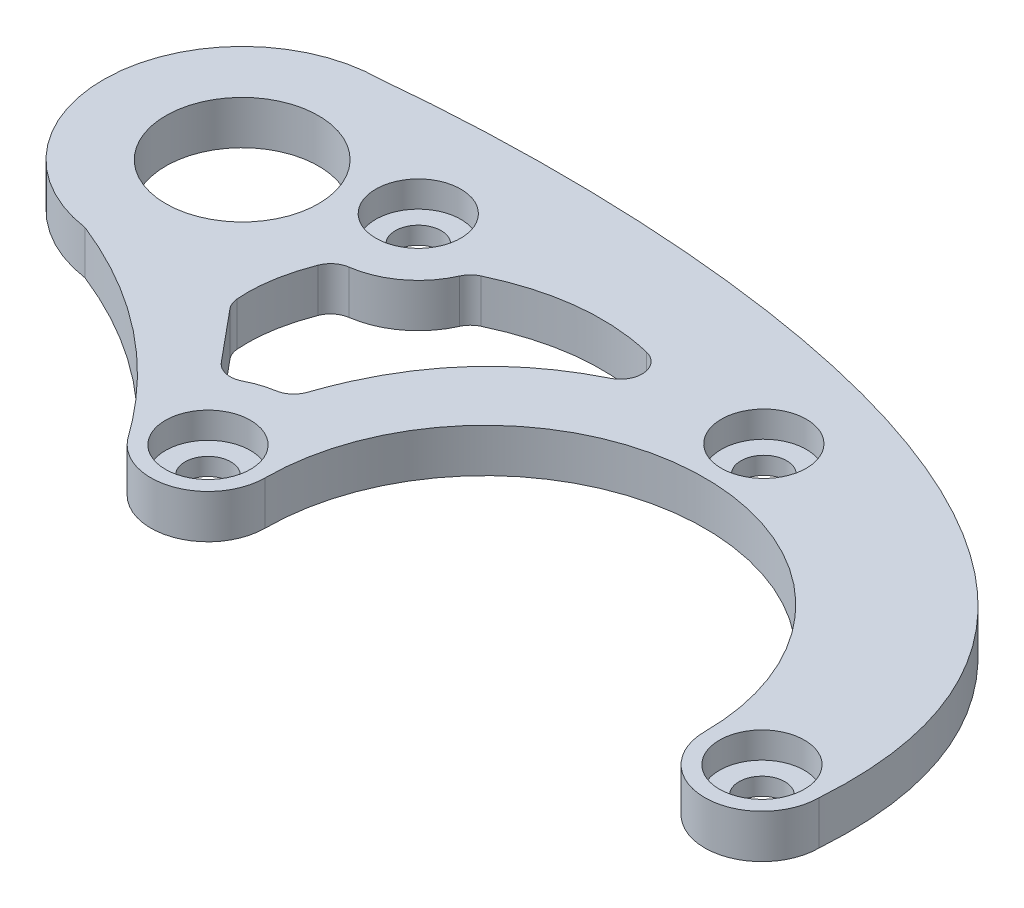
from build123d import *

# Parameters (mm, degrees)
SKETCH1_R           = 2.1
SKETCH1_R_2         = 7
BOSS_EXTRUDE1_DEPTH = 4
FILLET1_R           = 2
SKETCH2_R           = 3.9
CUT_EXTRUDE1_DEPTH  = 2.4


with BuildPart() as part:
    # Sketch1 → Boss-Extrude1 (new body)
    with BuildSketch(Plane(origin=(0, 0, 0), x_dir=(1, 0, 0), z_dir=(0, 1, 0))):
        with BuildLine():
            ThreePointArc((-20.156225815, 0), (0, 20.156225815), (20.156225815, 0))
            ThreePointArc((20.156225815, 0), (25.4, -5.243774185), (30.643774185, 0))
            add(Edge.make_bspline(
                [(-46.474516908, 36.934762739), (-23.164206568, 39.351897946), (33.373901801, 38.120150773), (30.643774185, 0)],
                knots=[0, 0, 0, 0, 1, 1, 1, 1], degree=3))
            ThreePointArc((-46.474516908, 36.934762739), (-59.166363236, 25.114100216), (-48.276532762, 11.615114404))
            add(Edge.make_bspline(
                [(-48.276532762, 11.615114404), (-40.793059369, 8.635332343), (-34.627763453, 3.802891886), (-29.780645012, -2.882206965)],
                knots=[0.158174001, 0.158174001, 0.158174001, 0.158174001, 0.985694322, 0.985694322, 0.985694322, 0.985694322], degree=3))
            add(Edge.make_bspline(
                [(-29.780645012, -2.882206965), (-29.696850917, -2.997774969), (-29.613450765, -3.113896649), (-29.530444557, -3.230572003)],
                knots=[0.985694322, 0.985694322, 0.985694322, 0.985694322, 1, 1, 1, 1], degree=3))
            ThreePointArc((-29.530444557, -3.230572003), (-23.691484685, -4.957634831), (-20.156225815, 0))
        make_face()
        with Locations(Location((-25.4, 0, 0), (0, 0, 270))):
            Circle(SKETCH1_R, mode=Mode.SUBTRACT)
        with Locations(Location((25.4, 0, 0), (0, 0, 270))):
            Circle(SKETCH1_R, mode=Mode.SUBTRACT)
        with Locations(Location((-46.474516908, 24.210813251, 0), (0, 0, 270))):
            Circle(SKETCH1_R_2, mode=Mode.SUBTRACT)
        with BuildLine():
            Line((-30.18742995, 5.773258566), (-35.582829026, 12.279679392))
            add(Edge.make_bspline(
                [(-34.116347467, 20.501234406), (-35.438334408, 17.651696826), (-35.927161595, 14.911178488), (-35.582829026, 12.279679392)],
                knots=[0, 0, 0, 0, 0.482948313, 0.482948313, 0.482948313, 0.482948313], degree=3))
            ThreePointArc((-34.116347467, 20.501234406), (-29.755996604, 21.898993805), (-27.020904781, 25.57127698))
            add(Edge.make_bspline(
                [(-27.020904781, 25.57127698), (-17.402553682, 30.495527598), (-7.5, 25.57127698)],
                knots=[0, 0, 0, 1, 1, 1], degree=2))
            add(Edge.make_bspline(
                [(-7.5, 25.57127698), (-21.293728183, 21.457376491), (-25.4, 7.5)],
                knots=[0, 0, 0, 1, 1, 1], degree=2))
            ThreePointArc((-25.4, 7.5), (-27.944657222, 7.0551201), (-30.18742995, 5.773258566))
        make_face(mode=Mode.SUBTRACT)
        with Locations(Location((-34.116347467, 28.001234406, 0), (0, 0, 270))):
            Circle(SKETCH1_R, mode=Mode.SUBTRACT)
        with Locations(Location((0, 25.57127698, 0), (0, 0, 270))):
            Circle(SKETCH1_R, mode=Mode.SUBTRACT)
    extrude(amount=BOSS_EXTRUDE1_DEPTH)

    # Fillet1
    fillet1_edges = [part.edges().sort_by_distance(p)[0] for p in [
        (-34.116347467, 2, -20.501234406),
        (-35.582829026, 2, -12.279679392),
        (-30.18742995, 2, -5.773258566),
        (-25.4, 2, -7.5),
        (-7.5, 2, -25.57127698),
        (-27.020904781, 2, -25.57127698),
    ]]
    fillet(fillet1_edges, radius=FILLET1_R)

    # Sketch2 → Cut-Extrude1 (cut)
    with BuildSketch(Plane(origin=(0, 4, 0), x_dir=(1, 0, 0), z_dir=(0, 1, 0))):
        with Locations(Location((-34.116347467, 28.001234406, 0), (0, 0, 270))):
            Circle(SKETCH2_R)
        with Locations(Location((0, 25.57127698, 0), (0, 0, 270))):
            Circle(SKETCH2_R)
        with Locations(Location((-25.4, 0, 0), (0, 0, 270))):
            Circle(SKETCH2_R)
        with Locations(Location((25.4, 0, 0), (0, 0, 270))):
            Circle(SKETCH2_R)
    extrude(amount=-CUT_EXTRUDE1_DEPTH, mode=Mode.SUBTRACT)


solid = part.part
